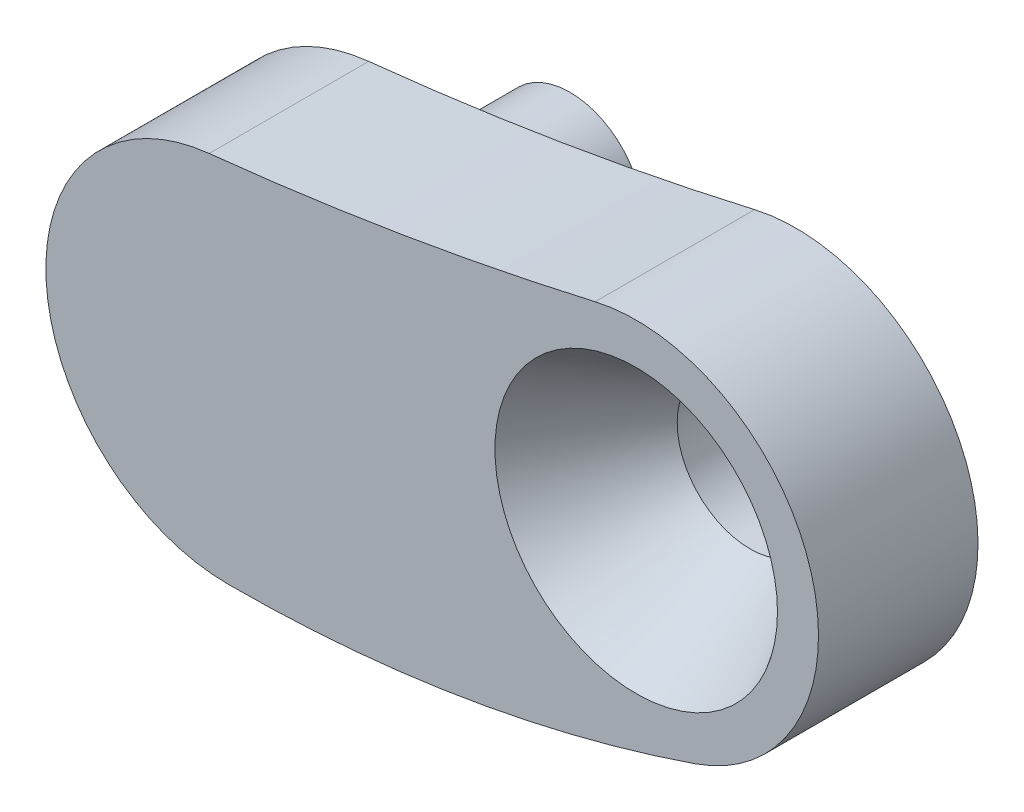
from build123d import *

# Parameters (mm, degrees)
SKETCH_1_R          = 1.6
EXTRUDE_1_DEPTH     = 4
SKETCH_2_R          = 1.6
EXTRUDE_2_DEPTH     = 4
CUT_EXTRUDE_START   = -0.5
CUT_EXTRUDE_1_DEPTH = 0.5


with BuildPart() as part:
    # 草图1 → 凸台-拉伸1 (new body)
    with BuildSketch(Plane.XY):
        with BuildLine():
            ThreePointArc((8.052200486, -22.104539206), (3.83936707, -22.943152918), (-0.416971099, -23.521792476))
            ThreePointArc((-0.416971099, -23.521792476), (-3.994548166, -27.708770095), (0, -31.5))
            ThreePointArc((0, -31.5), (5.198999585, -31.067996448), (10.255396865, -29.783835131))
            ThreePointArc((10.255396865, -29.783835131), (12.798012634, -24.898659157), (8.052200486, -22.104539206))
        make_face()
        with Locations((8.953124248, -26.001760829)):
            Circle(SKETCH_1_R, mode=Mode.SUBTRACT)
    extrude(amount=EXTRUDE_1_DEPTH)

    # 草图2 → 凸台-拉伸2 (add)
    with BuildSketch(Plane.XY):
        with Locations((0, -27.5)):
            Circle(SKETCH_2_R)
    extrude(amount=-EXTRUDE_2_DEPTH)

    # 草图3 → 切除-旋转1 (revolve, cut)
    with BuildSketch(Plane(origin=(0, -26.001760829, 0), x_dir=(1, 0, 0), z_dir=(0, 1, 0))):
        Polygon((8.953124248, -3.5), (5.853124248, -3.5), (7.353124248, -1), (8.953124248, -1), align=None)
    revolve(axis=Axis((8.953124248, -26.001760829, 1), (0, 0, 1)), mode=Mode.SUBTRACT)

    # 草图5 → 切除-拉伸1 (cut)
    with BuildSketch(Plane.XY.offset(4).offset(CUT_EXTRUDE_START)):
        with BuildLine():
            ThreePointArc((-0.416971099, -23.521792476), (-3.994548166, -27.708770095), (0, -31.5))
            ThreePointArc((0, -31.5), (5.198999585, -31.067996448), (10.255396865, -29.783835131))
            ThreePointArc((10.255396865, -29.783835131), (12.798012634, -24.898659157), (8.052200486, -22.104539206))
            ThreePointArc((8.052200486, -22.104539206), (3.83936707, -22.943152918), (-0.416971099, -23.521792476))
        make_face()
    extrude(amount=CUT_EXTRUDE_1_DEPTH, mode=Mode.SUBTRACT)


solid = part.part
